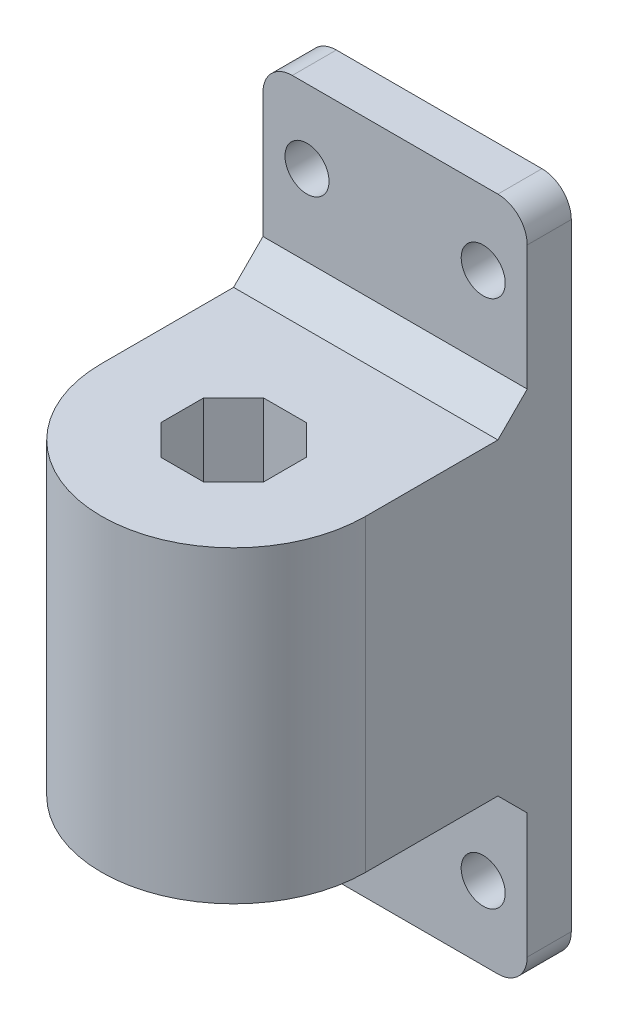
from build123d import *

# Parameters (mm, degrees)
BOSS_EXTRUDE1_DEPTH = 21
BOSS_EXTRUDE2_START = -17
SKETCH2_R           = 9
BOSS_EXTRUDE2_DEPTH = 17
SKETCH4_W           = 18
SKETCH4_H           = 12.5
SKETCH4_R           = 1.5
BOSS_EXTRUDE3_DEPTH = 3
FILLET1_R           = 2
CHAMFER1_SIZE       = 2


with BuildPart() as part:
    # Sketch1 → Boss-Extrude1 (new body)
    with BuildSketch(Plane(origin=(0, 0, 0), x_dir=(1, 0, 0), z_dir=(0, 1, 0))):
        with BuildLine():
            Line((-9, 0), (9, 0))
            Line((9, 0), (9, -14))
            ThreePointArc((9, -14), (0, -23), (-9, -14))
            Line((-9, -14), (-9, 0))
        make_face()
        Polygon((-2.742413779, -9.25), (-5.484827557, -14), (-2.742413779, -18.75), (2.742413779, -18.75), (5.484827557, -14), (2.742413779, -9.25), align=None, mode=Mode.SUBTRACT)
    extrude(amount=BOSS_EXTRUDE1_DEPTH)

    # Sketch2 → Boss-Extrude2 (add)
    with BuildSketch(Plane(origin=(0, 21, 0), x_dir=(1, 0, 0), z_dir=(0, 1, 0)).offset(BOSS_EXTRUDE2_START)):
        with Locations((0, -14)):
            Circle(SKETCH2_R)
        Polygon((3.5, -12.550252532), (1.449747468, -10.5), (-1.449747468, -10.5), (-3.5, -12.550252532), (-3.5, -15.449747468), (-1.449747468, -17.5), (1.449747468, -17.5), (3.5, -15.449747468), align=None, mode=Mode.SUBTRACT)
    extrude(amount=BOSS_EXTRUDE2_DEPTH)

    # Sketch4 → Boss-Extrude3 (add)
    # profile 1 of 2: a face of its own
    with BuildSketch(Plane(origin=(0, 0, 0), x_dir=(-1, 0, 0), z_dir=(0, 0, -1))):
        with Locations((0, 27.25)):
            Rectangle(SKETCH4_W, SKETCH4_H)
        with Locations((-6, 28.5)):
            Circle(SKETCH4_R, mode=Mode.SUBTRACT)
        with Locations((6, 28.5)):
            Circle(SKETCH4_R, mode=Mode.SUBTRACT)
    # profile 2 of 2: a face of its own
    with BuildSketch(Plane(origin=(0, 0, 0), x_dir=(-1, 0, 0), z_dir=(0, 0, -1))):
        with Locations((0, -6.25)):
            Rectangle(SKETCH4_W, SKETCH4_H)
        with Locations(Location((6, -7.5, 0), (0, 0, 180))):
            Circle(SKETCH4_R, mode=Mode.SUBTRACT)
        with Locations(Location((-6, -7.5, 0), (0, 0, 180))):
            Circle(SKETCH4_R, mode=Mode.SUBTRACT)
    extrude(amount=-BOSS_EXTRUDE3_DEPTH)

    # Fillet1
    fillet1_edges = [part.edges().sort_by_distance(p)[0] for p in [
        (9, 33.5, 1.5),
        (-9, 33.5, 1.5),
        (-9, -12.5, 1.5),
        (9, -12.5, 1.5),
    ]]
    fillet(fillet1_edges, radius=FILLET1_R)

    # Chamfer1
    chamfer1_edges = [part.edges().sort_by_distance(p)[0] for p in [
        (0, 21, 3),
        (0, 0, 3),
    ]]
    chamfer(chamfer1_edges, length=CHAMFER1_SIZE)


solid = part.part
